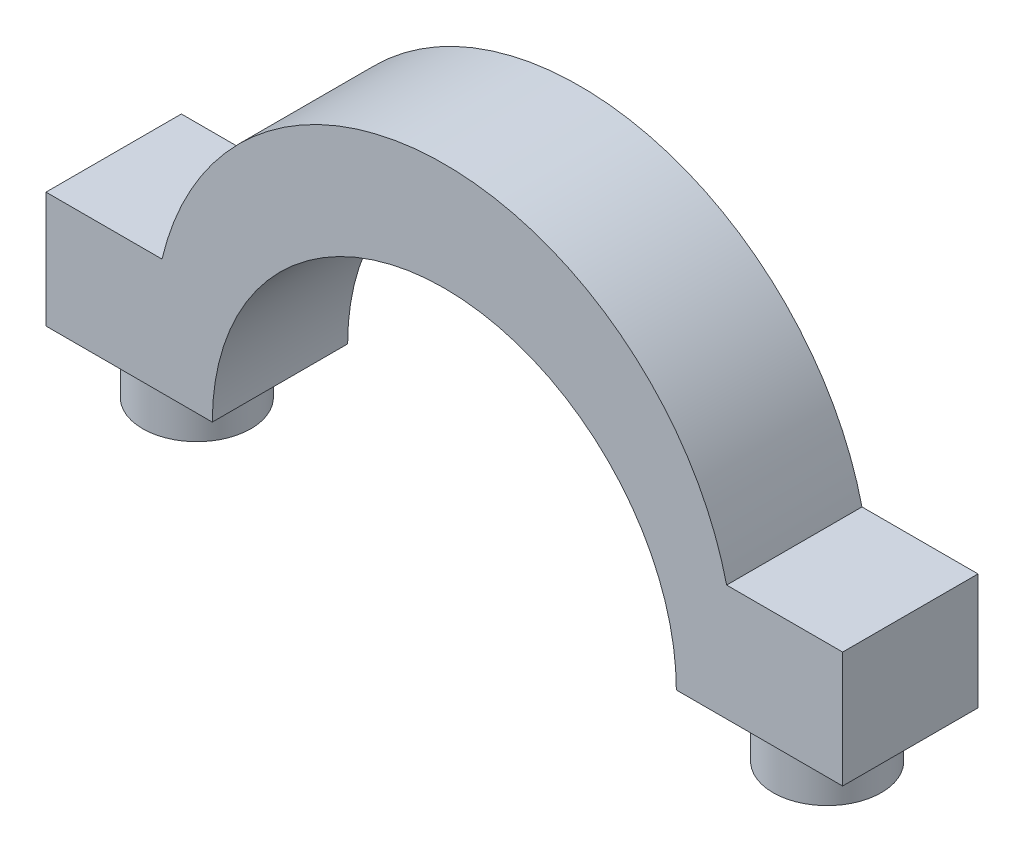
from build123d import *

# Parameters (mm, degrees)
BOSS_EXTRUDE1_DEPTH = 8.89
SKETCH3_R           = 3.556
BOSS_EXTRUDE2_DEPTH = 3.556


with BuildPart() as part:
    # Sketch2 → Boss-Extrude1 (new body)
    with BuildSketch(Plane.XY):
        with BuildLine():
            Line((-22.184810127, 0), (-33.106810127, 0))
            Line((-33.106810127, 0), (-33.106810127, 7.62))
            Line((-33.106810127, 7.62), (-25.486810127, 7.62))
            ThreePointArc((-25.486810127, 7.62), (-6.944810127, 22.300018764), (11.597189873, 7.62))
            Line((11.597189873, 7.62), (19.217189873, 7.62))
            Line((19.217189873, 7.62), (19.217189873, 0))
            Line((19.217189873, 0), (8.295189873, 0))
            ThreePointArc((8.295189873, 0), (-6.944810127, 15.24), (-22.184810127, 0))
        make_face()
    extrude(amount=BOSS_EXTRUDE1_DEPTH)

    # Sketch3 → Boss-Extrude2 (add)
    with BuildSketch(Plane.XZ):
        with Locations(Location((-27.645810127, 4.445, 0), (0, 0, 90))):
            Circle(SKETCH3_R)
        with Locations(Location((13.756189873, 4.445, 0), (0, 0, 90))):
            Circle(SKETCH3_R)
    extrude(amount=BOSS_EXTRUDE2_DEPTH)


solid = part.part
